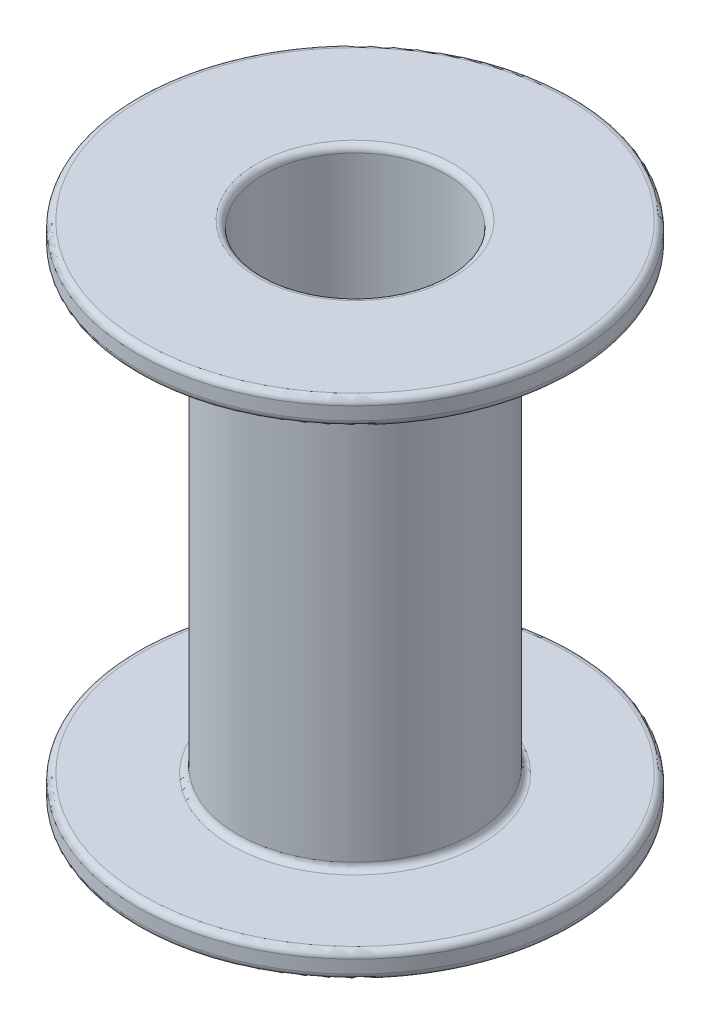
from build123d import *

# Parameters (mm, degrees)
SKETCH1_R           = 16.865
BOSS_EXTRUDE1_DEPTH = 39.05
SKETCH2_R           = 7.1
CUT_EXTRUDE1_DEPTH  = 46.757610842
SHELL5_T            = -2
FILLET1_R           = 0.5


with BuildPart() as part:
    # Sketch1 → Boss-Extrude1 (new body)
    with BuildSketch(Plane(origin=(0, 0, 0), x_dir=(1, 0, 0), z_dir=(0, 1, 0))):
        with Locations(Location((0, 0, 0), (0, 0, 270))):
            Circle(SKETCH1_R)
    extrude(amount=BOSS_EXTRUDE1_DEPTH)

    # Sketch2 → Cut-Extrude1 (cut, through all)
    with BuildSketch(Plane(origin=(0, 39.05, 0), x_dir=(1, 0, 0), z_dir=(0, 1, 0))):
        with Locations(Location((0, 0, 0), (0, 0, 270))):
            Circle(SKETCH2_R)
    extrude(amount=-CUT_EXTRUDE1_DEPTH, mode=Mode.SUBTRACT)

    # Shell5
    shell5_openings = [part.faces().sort_by_distance(p)[0] for p in [
        (0, 19.525, -16.865),
    ]]
    offset(amount=SHELL5_T, openings=shell5_openings, kind=Kind.INTERSECTION)

    # Fillet1
    fillet1_edges = [part.edges().sort_by_distance(p)[0] for p in [
        (0, 2, -16.865),
        (0, 37.05, -16.865),
        (0, 2, -9.1),
        (0, 37.05, -9.1),
        (0, 0, -16.865),
        (0, 39.05, -16.865),
        (0, 0, -7.1),
        (0, 39.05, -7.1),
    ]]
    fillet(fillet1_edges, radius=FILLET1_R)


solid = part.part
